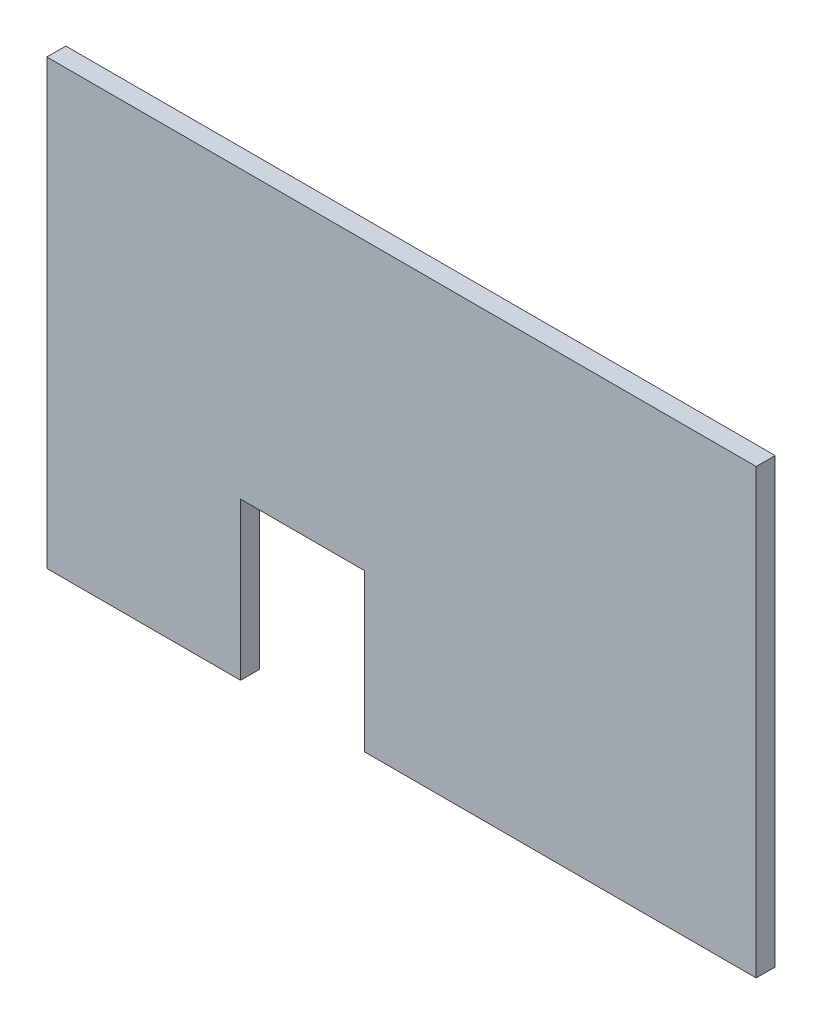
from build123d import *

# Parameters (mm, degrees)
RESSALTO_EXTRUS_O1_DEPTH = 3


with BuildPart() as part:
    # Esboço2 → Ressalto-extrusão1 (new body)
    with BuildSketch(Plane(origin=(0, 0, -150), x_dir=(-1, 0, 0), z_dir=(0, 0, -1))):
        Polygon((13.930315354, -35), (44.55, -35), (44.55, 35), (-67.55, 35), (-67.55, -35), (-5.675581899, -35), (-5.675581899, -10.205094859), (13.930315354, -10.205094859), align=None)
    extrude(amount=RESSALTO_EXTRUS_O1_DEPTH)


solid = part.part
